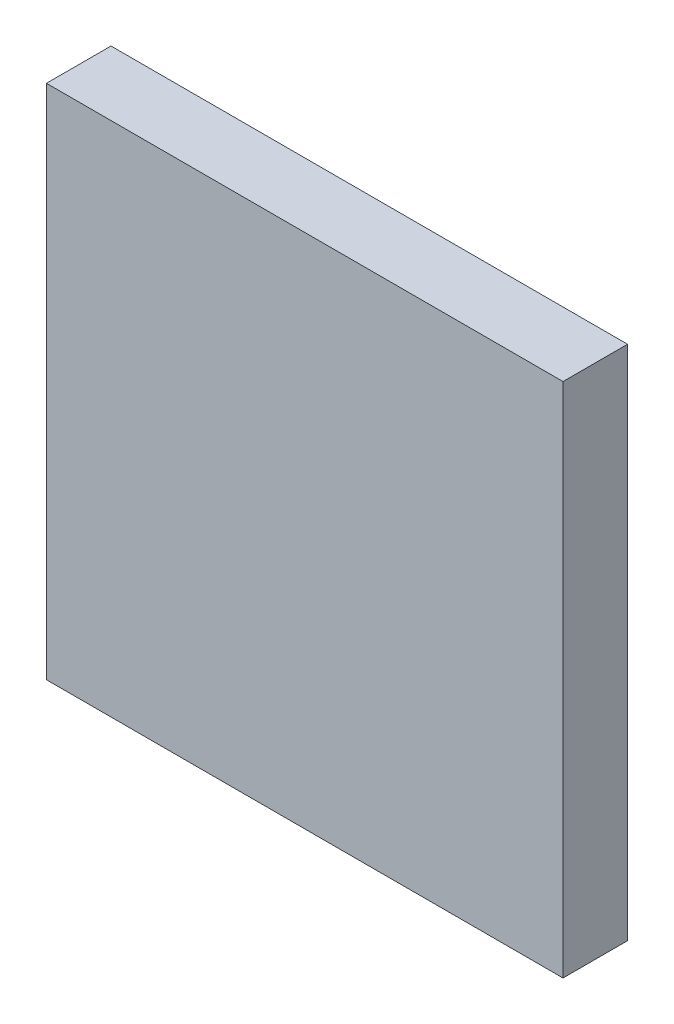
from build123d import *

# Parameters (mm, degrees)
SKETCH1_W           = 25.4
SKETCH1_H           = 25.4
BOSS_EXTRUDE1_DEPTH = 3.175


with BuildPart() as part:
    # Sketch1 → Boss-Extrude1 (new body)
    with BuildSketch(Plane.XY):
        with Locations((12.7, 12.7)):
            Rectangle(SKETCH1_W, SKETCH1_H)
    extrude(amount=BOSS_EXTRUDE1_DEPTH)


solid = part.part
